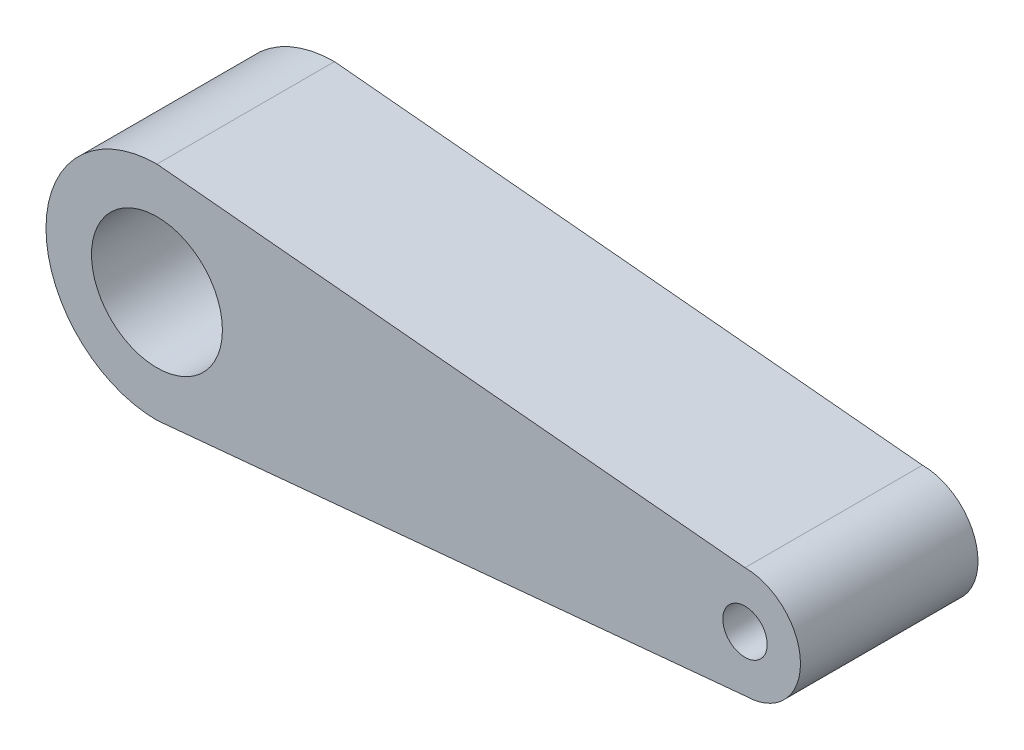
from build123d import *

# Parameters (mm, degrees)
ESQUISSE1_R        = 2.95
ESQUISSE1_R_2      = 1
BOSS_EXTRU_1_DEPTH = 8


with BuildPart() as part:
    # Esquisse1 → Boss.-Extru.1 (new body)
    with BuildSketch(Plane.XY):
        with BuildLine():
            Line((0, 5), (26.5, 2.5))
            ThreePointArc((26.5, 2.5), (29, 0), (26.5, -2.5))
            Line((26.5, -2.5), (0, -5))
            ThreePointArc((0, -5), (-5, 0), (0, 5))
        make_face()
        Circle(ESQUISSE1_R, mode=Mode.SUBTRACT)
        with Locations((26.5, 0)):
            Circle(ESQUISSE1_R_2, mode=Mode.SUBTRACT)
    extrude(amount=BOSS_EXTRU_1_DEPTH)


solid = part.part
